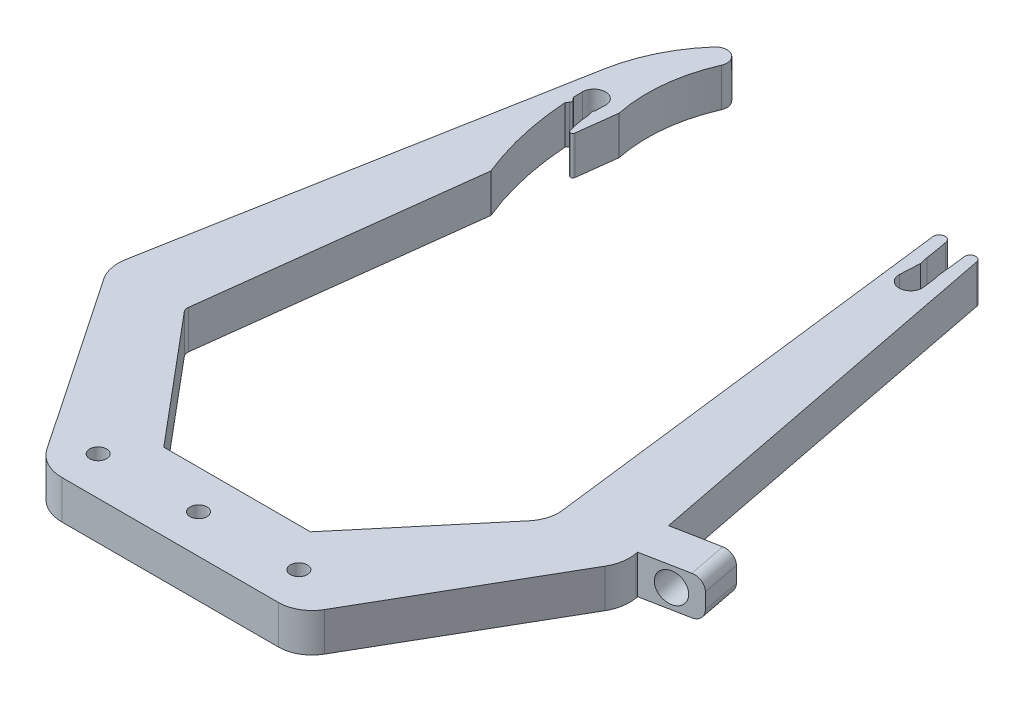
from build123d import *

# Parameters (mm, degrees)
EXTRUDE_1_DEPTH     = 10
CUT_EXTRUDE_1_REACH = 177.427
SKETCH_2_R          = 2.2
FILLET_1_R          = 0.6
SKETCH_3_W          = 10.144437824
SKETCH_3_H          = 10
EXTRUDE_2_DEPTH     = 15
CUT_EXTRUDE_2_REACH = 164.61
SKETCH_4_R          = 3.8
FILLET_2_R          = 3


with BuildPart() as part:
    # 草图1 → 凸台-拉伸1 (new body)
    with BuildSketch(Plane(origin=(0, 0, 0), x_dir=(1, 0, 0), z_dir=(0, 1, 0))):
        with BuildLine():
            Line((-19, 0), (19, 0))
            Line((19, 0), (44.854614973, 30.81233028))
            ThreePointArc((44.854614973, 30.81233028), (46.529317931, 33.929104052), (46.82231051, 37.455159084))
            Line((46.82231051, 37.455159084), (33.389549678, 146.856216784))
            ThreePointArc((33.389549678, 146.856216784), (34.753999407, 148.533855984), (36.376927445, 147.104765038))
            ThreePointArc((36.376927445, 147.104765038), (36.892496808, 144.296291333), (37.320815542, 141.473193853))
            Line((37.320815542, 141.473193853), (37.815132232, 139.258398169))
            ThreePointArc((37.815132232, 139.258398169), (37.817176658, 139.245056143), (37.817405692, 139.231560332))
            Line((37.817405692, 139.231560332), (37.557917484, 134.104765038))
            ThreePointArc((37.557917484, 134.104765038), (40.754926912, 130.959847465), (43.503129215, 134.503681536))
            Line((43.503129215, 134.503681536), (43.077003941, 137.813685213))
            Line((43.077003941, 137.813685213), (42.807637334, 138.925557366))
            ThreePointArc((42.807637334, 138.925557366), (42.806315787, 138.931905108), (42.80540838, 138.938325149))
            Line((42.80540838, 138.938325149), (42.129277547, 145.175318139))
            Line((42.129277547, 145.175318139), (41.965181023, 146.44996701))
            ThreePointArc((41.965181023, 146.44996701), (43.130662006, 148.010841711), (44.727999785, 146.895858405))
            Line((44.727999785, 146.895858405), (66.016482503, 37.376109146))
            ThreePointArc((66.016482503, 37.376109146), (66.063066684, 33.817543133), (64.860464706, 30.468019192))
            Line((64.860464706, 30.468019192), (38.23055697, -15.656334008))
            ThreePointArc((38.23055697, -15.656334008), (35.050772773, -18.836118205), (30.707106781, -20))
            Line((30.707106781, -20), (5.707106781, -20))
            Line((5.707106781, -20), (-5.707106781, -20))
            Line((-5.707106781, -20), (-25.399802658, -20))
            ThreePointArc((-25.399802658, -20), (-30.087775174, -18.833058003), (-33.681629288, -15.604582738))
            Line((-33.681629288, -15.604582738), (-64.860464706, 30.468019192))
            ThreePointArc((-64.860464706, 30.468019192), (-66.063066684, 33.817543133), (-66.016482503, 37.376109146))
            Line((-66.016482503, 37.376109146), (-46.829620455, 141.890886738))
            ThreePointArc((-46.829620455, 141.890886738), (-43.465252598, 152.148967586), (-37.480163066, 161.13372674))
            ThreePointArc((-37.480163066, 161.13372674), (-33.620696298, 161.680216975), (-32.479267504, 157.953116813))
            ThreePointArc((-32.479267504, 157.953116813), (-35.579400499, 146.14570295), (-34.973851142, 133.953116813))
            Line((-34.973851142, 133.953116813), (-47.176674229, 34.569098196))
            ThreePointArc((-47.176674229, 34.569098196), (-47.109221395, 33.75732882), (-46.723670812, 33.03978429))
            Line((-46.723670812, 33.03978429), (-19, 0))
        make_face()
    extrude(amount=EXTRUDE_1_DEPTH)

    # 草图2 → 切除-拉伸1 (cut, up to next)
    with BuildSketch(Plane(origin=(0, 10, 0), x_dir=(1, 0, 0), z_dir=(0, 1, 0)), mode=Mode.PRIVATE) as cut_extrude_1_sk1:
        with Locations(Location((0, -10, 0), (0, 0, 270))):
            Circle(SKETCH_2_R)
    cut_extrude_1_tool1 = extrude(cut_extrude_1_sk1.sketch, amount=-CUT_EXTRUDE_1_REACH, mode=Mode.PRIVATE) & part.part
    # 草图2 → 切除-拉伸1 (cut, up to next)
    with BuildSketch(Plane(origin=(0, 10, 0), x_dir=(1, 0, 0), z_dir=(0, 1, 0)), mode=Mode.PRIVATE) as cut_extrude_1_sk2:
        with Locations(Location((-26, -10, 0), (0, 0, 270))):
            Circle(SKETCH_2_R)
    cut_extrude_1_tool2 = extrude(cut_extrude_1_sk2.sketch, amount=-CUT_EXTRUDE_1_REACH, mode=Mode.PRIVATE) & part.part
    # 草图2 → 切除-拉伸1 (cut, up to next)
    with BuildSketch(Plane(origin=(0, 10, 0), x_dir=(1, 0, 0), z_dir=(0, 1, 0)), mode=Mode.PRIVATE) as cut_extrude_1_sk3:
        with Locations(Location((26, -10, 0), (0, 0, 270))):
            Circle(SKETCH_2_R)
    cut_extrude_1_tool3 = extrude(cut_extrude_1_sk3.sketch, amount=-CUT_EXTRUDE_1_REACH, mode=Mode.PRIVATE) & part.part
    # 草图2 → 切除-拉伸1 (cut, up to next)
    with BuildSketch(Plane(origin=(0, 10, 0), x_dir=(1, 0, 0), z_dir=(0, 1, 0)), mode=Mode.PRIVATE) as cut_extrude_1_sk4:
        with BuildLine():
            Line((-36.549558395, 121.120011078), (-38.607748185, 104.35740041))
            ThreePointArc((-38.607748185, 104.35740041), (-42.47341142, 116.594845153), (-44.332546284, 129.292956179))
            Line((-44.332546284, 129.292956179), (-43.845113062, 129.987442667))
            ThreePointArc((-43.845113062, 129.987442667), (-43.702378092, 130.509625408), (-43.924830211, 131.003146575))
            Line((-43.924830211, 131.003146575), (-44.447419993, 131.543571067))
            ThreePointArc((-44.447419993, 131.543571067), (-44.482588605, 132.737575539), (-44.499925482, 133.931972015))
            ThreePointArc((-44.499925482, 133.931972015), (-41.418283025, 136.952003662), (-38.505677682, 133.768634142))
            ThreePointArc((-38.505677682, 133.768634142), (-38.556072369, 132.542586282), (-38.556286633, 131.315503182))
            Line((-38.556286633, 131.315503182), (-38.546052546, 131.325051295))
            ThreePointArc((-38.546052546, 131.325051295), (-38.780683801, 130.91622187), (-38.744387532, 130.446247504))
            Line((-38.744387532, 130.446247504), (-38.486748585, 129.793872308))
            ThreePointArc((-38.486748585, 129.793872308), (-37.841140795, 125.384806825), (-36.549558395, 121.120011078))
        make_face()
    cut_extrude_1_tool4 = extrude(cut_extrude_1_sk4.sketch, amount=-CUT_EXTRUDE_1_REACH, mode=Mode.PRIVATE) & part.part
    add(cut_extrude_1_tool1.solids().sort_by_distance((0, 10, 10))[0], mode=Mode.SUBTRACT)
    add(cut_extrude_1_tool2.solids().sort_by_distance((-26, 10, 10))[0], mode=Mode.SUBTRACT)
    add(cut_extrude_1_tool3.solids().sort_by_distance((26, 10, 10))[0], mode=Mode.SUBTRACT)
    add(cut_extrude_1_tool4.solids().sort_by_distance((-40.502089, 10, -123.156617))[0], mode=Mode.SUBTRACT)

    # 圆角1
    fillet_1_edges = [part.edges().sort_by_distance(p)[0] for p in [
        (-36.549558395, 5, -121.120011078),
        (-34.973851142, 5, -133.953116813),
    ]]
    fillet(fillet_1_edges, radius=FILLET_1_R)

    # 草图3 → 凸台-拉伸2 (add)
    with BuildSketch(Plane(origin=(70.613618069, 0, -13.725896909), x_dir=(-0.19080899537654988, 0, -0.9816271834476631), z_dir=(0.9816271834476631, 0, -0.19080899537654988))):
        with Locations((29.616052291, 5)):
            Rectangle(SKETCH_3_W, SKETCH_3_H)
    extrude(amount=EXTRUDE_2_DEPTH)

    # 草图4 → 切除-拉伸2 (cut, up to next)
    with BuildSketch(Plane(origin=(-4.68318419, 0, -24.092894031), x_dir=(0.981627183447663, 0, -0.19080899537654997), z_dir=(0.19080899537654997, 0, 0.981627183447663)), mode=Mode.PRIVATE) as cut_extrude_2_sk1:
        with Locations((79.435271618, 5)):
            Circle(SKETCH_4_R)
    cut_extrude_2_tool1 = extrude(cut_extrude_2_sk1.sketch, amount=-CUT_EXTRUDE_2_REACH, mode=Mode.PRIVATE) & part.part
    add(cut_extrude_2_tool1.solids().sort_by_distance((73.292638, 5, -39.249858))[0], mode=Mode.SUBTRACT)

    # 圆角2
    fillet_2_edges = [part.edges().sort_by_distance(p)[0] for p in [
        (79.687016636, 0, -45.659953836),
        (79.687016636, 10, -45.659953836),
    ]]
    fillet(fillet_2_edges, radius=FILLET_2_R)


solid = part.part
